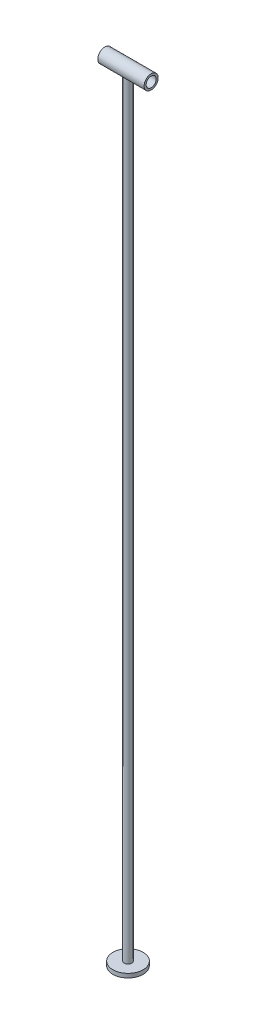
from build123d import *

# Parameters (mm, degrees)
KLIP_SKETCH1_R                = 75
KLIP_BOSS_EXTRUDE1_DEPTH      = 20
KLIP_BOSS_EXTRUDE3_DEPTH      = 115
KLIP_BOSS_EXTRUDE3_DEPTH_BACK = 115
KLIP_SKETCH3_R                = 35
KLIP_SKETCH3_R_2              = 25
KLIP_BOSS_EXTRUDE2_REACH      = 3874.435
KLIP_BOSS_EXTRUDE2_END_RADIUS = 35
KLIP_SKETCH2_R                = 18.75


with BuildPart() as part:
    # klip_Sketch1 → klip_Boss-Extrude1 (new body)
    with BuildSketch(Plane(origin=(0, 0, 0), x_dir=(1, 0, 0), z_dir=(0, 1, 0))):
        Circle(KLIP_SKETCH1_R)
    extrude(amount=-KLIP_BOSS_EXTRUDE1_DEPTH)

    # klip_Boss-Extrude2: up to this cylinder (the profile starts outside it)
    klip_boss_extrude2_end = Plane(origin=(0, 3835, 0), z_dir=(1, 0, 0)) * Cylinder(KLIP_BOSS_EXTRUDE2_END_RADIUS, 7819.87, mode=Mode.PRIVATE)
    # klip_Sketch2 → klip_Boss-Extrude2 (add, up to the surface)
    with BuildSketch(Plane(origin=(0, 0, 0), x_dir=(1, 0, 0), z_dir=(0, 1, 0)), mode=Mode.PRIVATE) as klip_boss_extrude2_sk1:
        Circle(KLIP_SKETCH2_R)
    klip_boss_extrude2_tool1 = extrude(klip_boss_extrude2_sk1.sketch, amount=KLIP_BOSS_EXTRUDE2_REACH, mode=Mode.PRIVATE) - klip_boss_extrude2_end
    add(klip_boss_extrude2_tool1.solids().sort_by_distance((0, 0, 0))[0])


with BuildPart() as body_2:
    # klip_Sketch3 → klip_Boss-Extrude3 (new, two sides: drawn at the far end of the back side and taken through both)
    with BuildSketch(Plane(origin=(0, 0, 0), x_dir=(0, 0, -1), z_dir=(1, 0, 0)).offset(-KLIP_BOSS_EXTRUDE3_DEPTH_BACK)):
        with Locations((0, 3835)):
            Circle(KLIP_SKETCH3_R)
        with Locations((0, 3835)):
            Circle(KLIP_SKETCH3_R_2, mode=Mode.SUBTRACT)
    extrude(amount=KLIP_BOSS_EXTRUDE3_DEPTH + KLIP_BOSS_EXTRUDE3_DEPTH_BACK)


solid = Compound([part.part, body_2.part])
